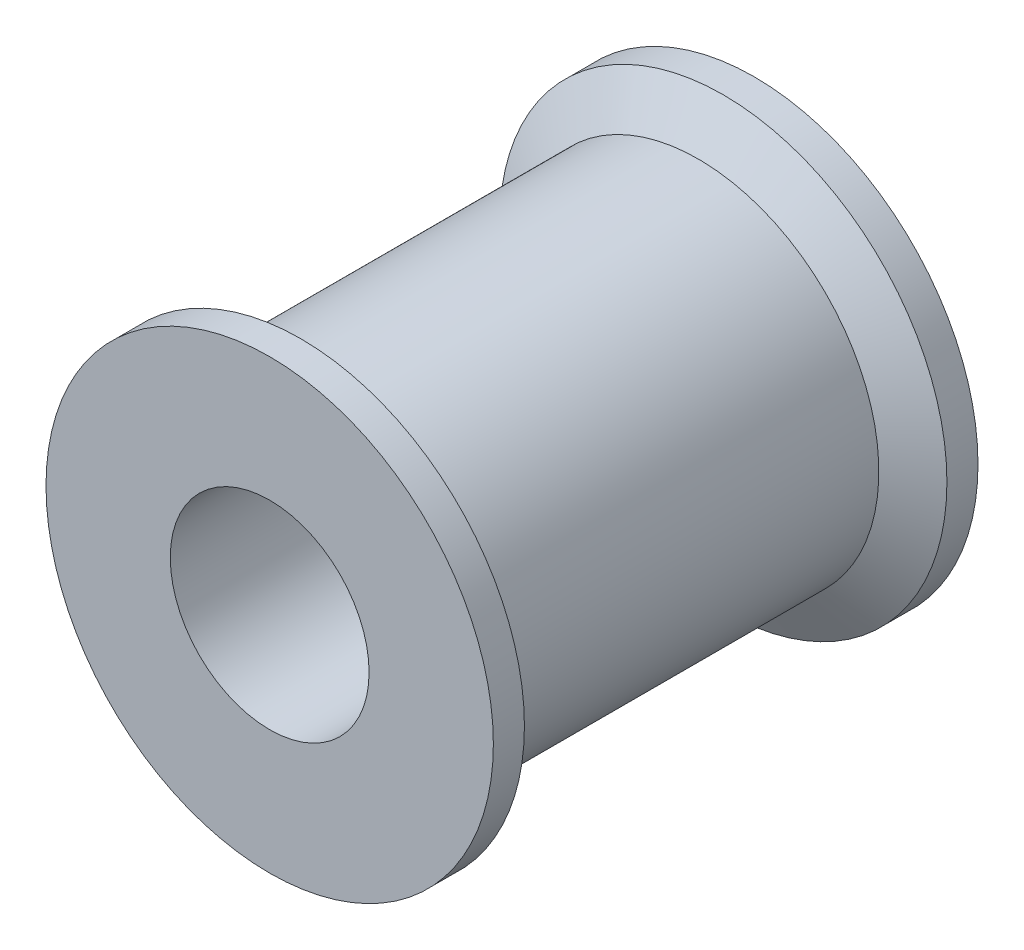
from build123d import *

# Parameters (mm, degrees)
ODEBRAT_VYSUNUT_M1_DEPTH      = 29.948229652
ODEBRAT_VYSUNUT_M1_DEPTH_BACK = 29.948229652
SKICA2_W                      = 9.5
SKICA2_H                      = 6.5


with BuildPart() as part:
    # Skica1 → Rotovat1 (revolve)
    with BuildSketch(Plane(origin=(0, 0, 0), x_dir=(0, 0, -1), z_dir=(1, 0, 0)), mode=Mode.PRIVATE) as rotovat1_sk:
        Polygon((0, 4), (0, 4.75), (-6.5, 4.75), (-6.5, 9), (-7.75, 9), (-8.75, 7.26), (-23.75, 7.26), (-24.75, 9), (-26, 9), (-26, 4), align=None)
    revolve(rotovat1_sk.sketch.rotate(Axis((0, 0, 0), (0, 0, 1)), 90), axis=Axis((0, 0, 0), (0, 0, 1)))

    # Skica2 → Odebrat vysunutím1 (cut, two sides: drawn at the far end of the back side and taken through both)
    with BuildSketch(Plane(origin=(0, 0, 0), x_dir=(1, 0, 0), z_dir=(0, 1, 0)).offset(-ODEBRAT_VYSUNUT_M1_DEPTH_BACK)):
        with Locations((0, -3.25)):
            Rectangle(SKICA2_W, SKICA2_H)
    extrude(amount=ODEBRAT_VYSUNUT_M1_DEPTH + ODEBRAT_VYSUNUT_M1_DEPTH_BACK, mode=Mode.SUBTRACT)


solid = part.part
